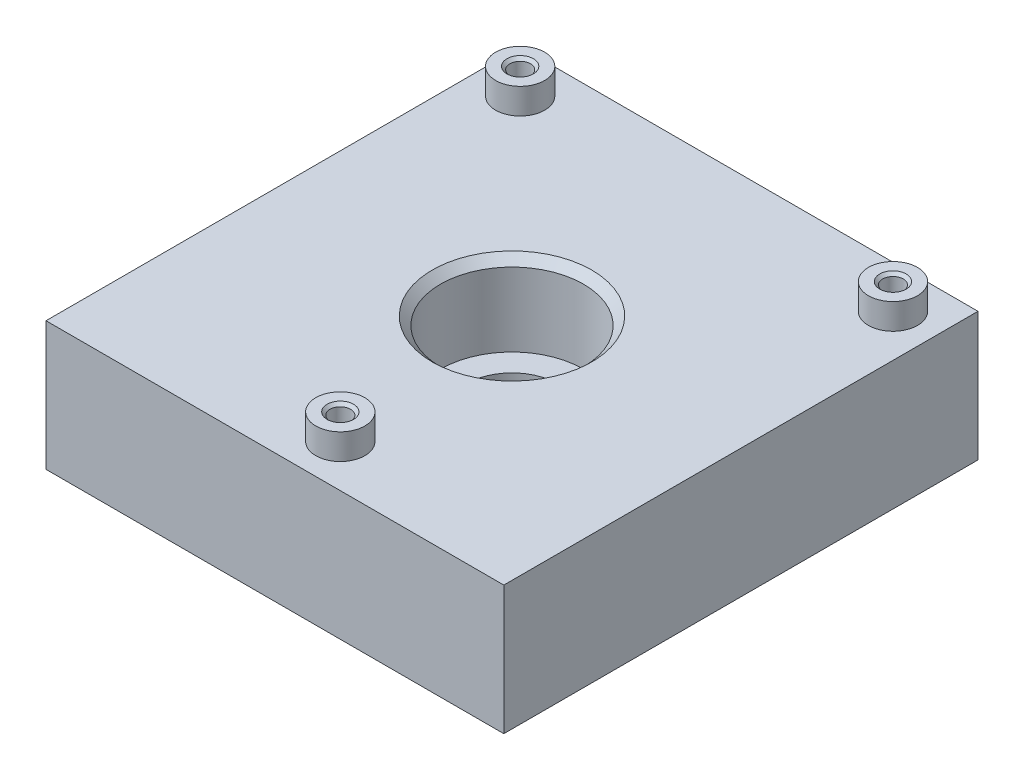
from build123d import *

# Parameters (mm, degrees)
SKETCH1_W                       = 35.56
SKETCH1_H                       = 36.83
BOSS_EXTRUDE1_DEPTH             = 10
SKETCH5_R                       = 1.905
BOSS_EXTRUDE2_DEPTH             = 2
M2X0_4_TAPPED_HOLE1_D           = 1.6
M2X0_4_TAPPED_HOLE1_CSINK_D     = 2.05
M2X0_4_TAPPED_HOLE1_CSINK_ANGLE = 90


with BuildPart() as part:
    # Sketch1 → Boss-Extrude1 (new body)
    with BuildSketch(Plane(origin=(0, 0, 0), x_dir=(1, 0, 0), z_dir=(0, 1, 0))):
        Rectangle(SKETCH1_W, SKETCH1_H)
    extrude(amount=BOSS_EXTRUDE1_DEPTH)

    # Sketch4 → CBORE for 1/4 Socket Head Cap Screw1 (revolve, cut)
    with BuildSketch(Plane(origin=(0, 10, 0), x_dir=(0, 0, 1), z_dir=(1, 0, 0))):
        Polygon((0, 0), (0, 10), (3.57124, 10), (3.57124, 6.35), (5.55625, 6.35), (5.55625, 0.635), (6.19125, 0), align=None)
    revolve(axis=Axis((0, 16.35, 0), (0, -1, 0)), mode=Mode.SUBTRACT)

    # Sketch5 → Boss-Extrude2 (add)
    with BuildSketch(Plane(origin=(0, 10, 0), x_dir=(1, 0, 0), z_dir=(0, 1, 0))):
        with Locations(Location((-14.478, 15.113, 0), (0, 0, 270))):
            Circle(SKETCH5_R)
        with Locations(Location((14.478, 15.113, 0), (0, 0, 270))):
            Circle(SKETCH5_R)
        with Locations(Location((1.778, -15.113, 0), (0, 0, 270))):
            Circle(SKETCH5_R)
    extrude(amount=BOSS_EXTRUDE2_DEPTH)

    # M2x0.4 Tapped Hole1 (through all)
    with Locations(Plane(origin=(0, 12, 0), x_dir=(1, 0, 0), z_dir=(0, 1, 0))):
        with Locations((-14.478, 15.113), (14.478, 15.113), (1.778, -15.113)):
            CounterSinkHole(M2X0_4_TAPPED_HOLE1_D / 2, M2X0_4_TAPPED_HOLE1_CSINK_D / 2, counter_sink_angle=M2X0_4_TAPPED_HOLE1_CSINK_ANGLE)


solid = part.part
